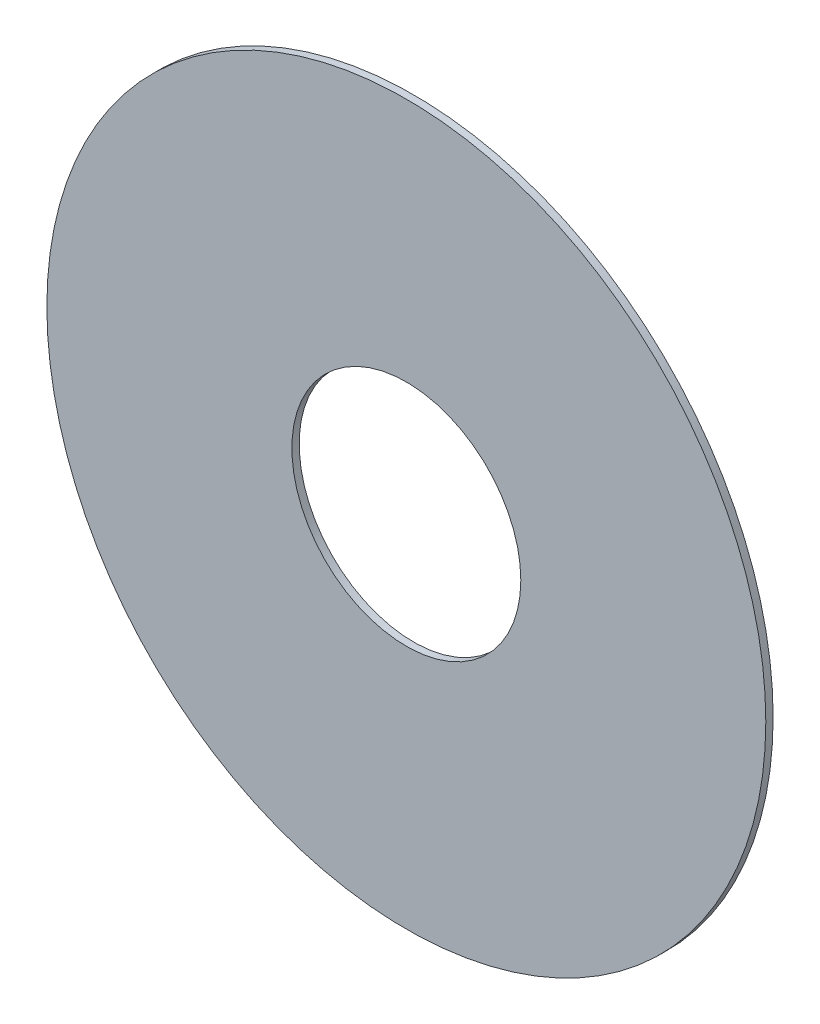
from build123d import *

# Parameters (mm, degrees)
SKETCH1_R          = 99.695
SKETCH1_R_2        = 31.75
BASE_EXTRUDE_DEPTH = 2.032


with BuildPart() as part:
    # Sketch1 → Base-Extrude (new body)
    with BuildSketch(Plane.XY):
        Circle(SKETCH1_R)
        Circle(SKETCH1_R_2, mode=Mode.SUBTRACT)
    extrude(amount=BASE_EXTRUDE_DEPTH)


solid = part.part
